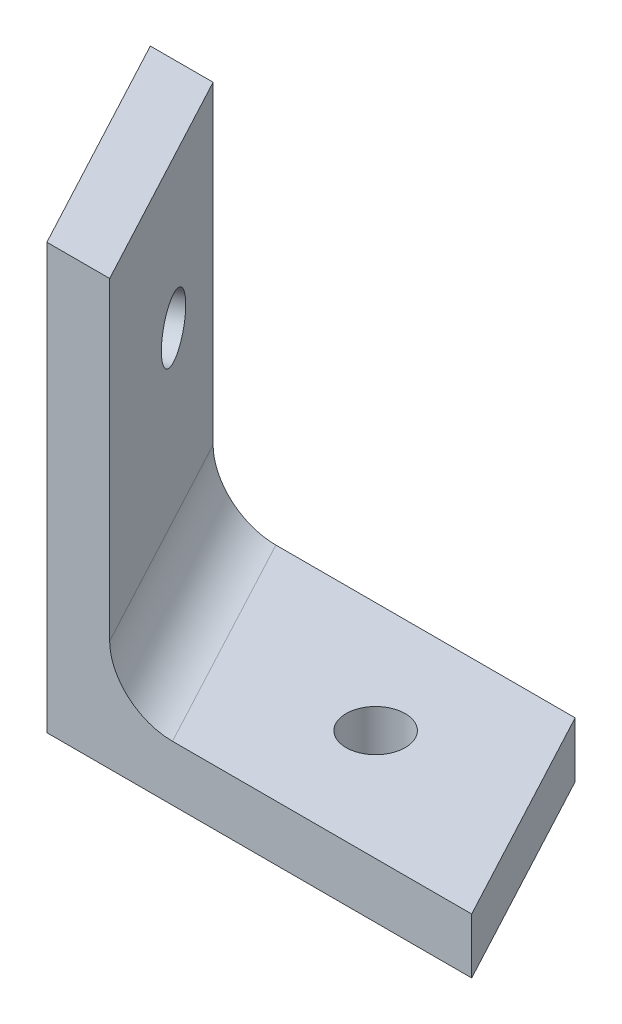
from build123d import *

# Parameters (mm, degrees)
EXTRUDE_1_DEPTH     = 3
EXTRUDE_2_DEPTH     = 20
CUT_EXTRUDE_1_REACH = 86.581
SKETCH_3_R          = 1.6
CUT_EXTRUDE_2_REACH = 57.839
SKETCH_4_R          = 1.6
FILLET_1_R          = 3


with BuildPart() as part:
    # 草图1 → 凸台-拉伸1 (new body)
    with BuildSketch(Plane(origin=(0, 0, 0), x_dir=(1, 0, 0), z_dir=(0, 1, 0))):
        Polygon((-80, 15), (-57, 15), (-50.6, 3), (-73.6, 3), align=None)
    extrude(amount=EXTRUDE_1_DEPTH)

    # 草图2 → 凸台-拉伸2 (add)
    with BuildSketch(Plane(origin=(0, 3, 0), x_dir=(1, 0, 0), z_dir=(0, 1, 0))):
        Polygon((-80, 15), (-73.6, 3), (-70.2, 3), (-76.6, 15), align=None)
    extrude(amount=EXTRUDE_2_DEPTH)

    # 草图3 → 切除-拉伸1 (cut, up to next)
    with BuildSketch(Plane(origin=(0, 0, 0), x_dir=(1, 0, 0), z_dir=(0, 1, 0)), mode=Mode.PRIVATE) as cut_extrude_1_sk1:
        with Locations(Location((-61.8, 9, 0), (0, 0, 270))):
            Circle(SKETCH_3_R)
    cut_extrude_1_tool1 = extrude(cut_extrude_1_sk1.sketch, amount=CUT_EXTRUDE_1_REACH, mode=Mode.PRIVATE) & part.part
    add(cut_extrude_1_tool1.solids().sort_by_distance((-61.8, 0, -9))[0], mode=Mode.SUBTRACT)

    # 草图4 → 切除-拉伸2 (cut, up to next)
    with BuildSketch(Plane(origin=(-56.055363322, 0, 29.896193772), x_dir=(-0.4705882352941182, 0, -0.8823529411764703), z_dir=(0.8823529411764703, 0, -0.4705882352941182)), mode=Mode.PRIVATE) as cut_extrude_2_sk1:
        with Locations(Location((44.082352941, 15, 0), (0, 0, 180))):
            Circle(SKETCH_4_R)
    cut_extrude_2_tool1 = extrude(cut_extrude_2_sk1.sketch, amount=CUT_EXTRUDE_2_REACH, mode=Mode.PRIVATE) & part.part
    add(cut_extrude_2_tool1.solids().sort_by_distance((-76.8, 15, -9))[0], mode=Mode.SUBTRACT)

    # 圆角1
    fillet_1_edges = [part.edges().sort_by_distance(p)[0] for p in [
        (-73.4, 3, -9),
    ]]
    fillet(fillet_1_edges, radius=FILLET_1_R)


solid = part.part
